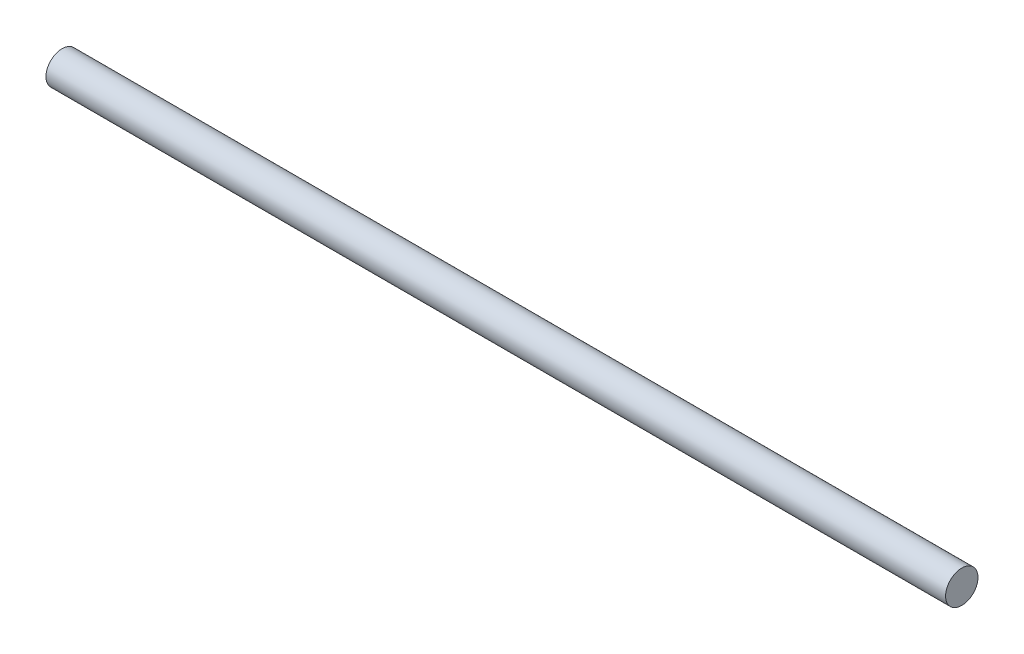
from build123d import *

# Parameters (mm, degrees)
SKETCH1_W = 444
SKETCH1_H = 8


with BuildPart() as part:
    # Sketch1 → Revolve1 (revolve)
    with BuildSketch(Plane(origin=(0, 0, 0), x_dir=(-1, 0, 0), z_dir=(0, 1, 0)), mode=Mode.PRIVATE) as revolve1_sk:
        with Locations((0, 4)):
            Rectangle(SKETCH1_W, SKETCH1_H)
    revolve(revolve1_sk.sketch.rotate(Axis((222, 0, 0), (-1, 0, 0)), 180), axis=Axis((222, 0, 0), (-1, 0, 0)))


solid = part.part
